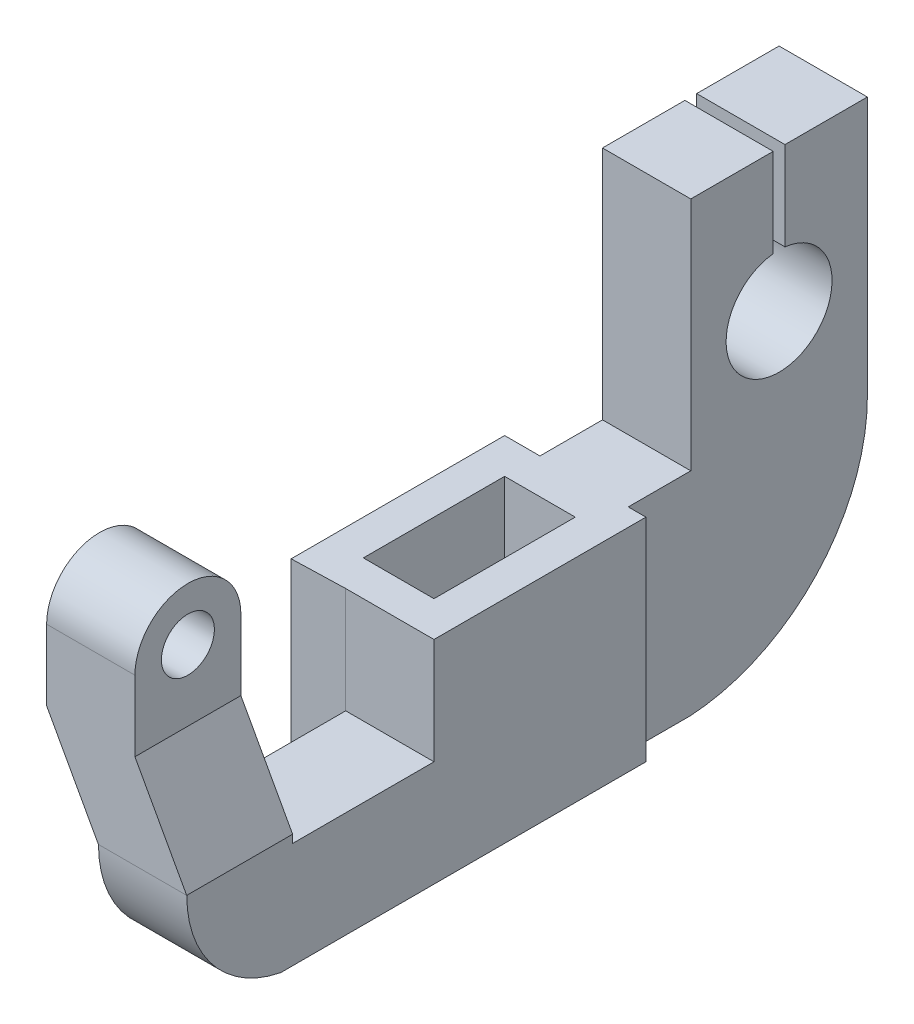
from build123d import *

# Parameters (mm, degrees)
BOSS_EXTRUDE1_DEPTH = 15
BOSS_EXTRUDE2_DEPTH = 18
BOSS_EXTRUDE3_DEPTH = 15
SKETCH4_R           = 4.5
CUT_EXTRUDE1_DEPTH  = 15
BOSS_EXTRUDE4_DEPTH = 36
SKETCH6_W           = 12
SKETCH6_H           = 24
CUT_EXTRUDE2_DEPTH  = 61.125389812
SKETCH7_W           = 15
SKETCH7_H           = 10.623328836
BOSS_EXTRUDE5_DEPTH = 36
BOSS_EXTRUDE6_DEPTH = 15


with BuildPart() as part:
    # Sketch1 → Boss-Extrude1 (new body)
    with BuildSketch(Plane(origin=(0, 0, 0), x_dir=(0, 0, -1), z_dir=(1, 0, 0))):
        with BuildLine():
            Line((-25.766620498, 0), (36.265250882, 0))
            Line((36.265250882, 0), (36.265250882, 36))
            Line((36.265250882, 36), (0.265250882, 36))
            Line((0.265250882, 36), (0.265250882, 18))
            Line((0.265250882, 18), (-23.734749118, 18))
            Line((-23.734749118, 18), (-23.734749118, 19.356781067))
            Line((-23.734749118, 19.356781067), (-41.734749118, 19.356781067))
            ThreePointArc((-41.734749118, 19.356781067), (-37.227535866, 6.810206785), (-25.766620498, 0))
        make_face()
    extrude(amount=-BOSS_EXTRUDE1_DEPTH)

    # Sketch2 → Boss-Extrude2 (add)
    with BuildSketch(Plane.XY.offset(23.75)):
        Polygon((-15, 19.356781067), (-23.791342675, 35.356781067), (-23.791342675, 47.356781067), (-8.791342675, 47.356781067), (-8.791342675, 35.356781067), (0, 19.356781067), align=None)
    extrude(amount=BOSS_EXTRUDE2_DEPTH)

    # Sketch3 → Boss-Extrude3 (add)
    with BuildSketch(Plane(origin=(-8.791342675, 0, 0), x_dir=(0, 0, -1), z_dir=(1, 0, 0))):
        with BuildLine():
            Line((-41.75, 47.356781067), (-23.75, 47.356781067))
            ThreePointArc((-23.75, 47.356781067), (-32.75, 56.356781067), (-41.75, 47.356781067))
        make_face()
    extrude(amount=-BOSS_EXTRUDE3_DEPTH)

    # Sketch4 → Cut-Extrude1 (cut)
    with BuildSketch(Plane(origin=(-8.791342675, 0, 0), x_dir=(0, 0, -1), z_dir=(1, 0, 0))):
        with Locations((-32.75, 47.356781067)):
            Circle(SKETCH4_R)
    extrude(amount=-CUT_EXTRUDE1_DEPTH, mode=Mode.SUBTRACT)


with BuildPart() as body_2:
    # Sketch5 → Boss-Extrude4 (new body)
    with BuildSketch(Plane(origin=(0, 36, 0), x_dir=(1, 0, 0), z_dir=(0, 1, 0))):
        Polygon((-15, 36.265250882), (-24, 36.265250882), (-24, 0), (-15, 0.265250882), align=None)
    extrude(amount=-BOSS_EXTRUDE4_DEPTH)


with BuildPart() as cut_extrude2_tool:
    # Sketch6 → Cut-Extrude2 (new, through all)
    with BuildSketch(Plane(origin=(0, 36, 0), x_dir=(1, 0, 0), z_dir=(0, 1, 0))):
        with Locations((-12, 18.265250882)):
            Rectangle(SKETCH6_W, SKETCH6_H)
    extrude(amount=-CUT_EXTRUDE2_DEPTH)


with BuildPart() as part_1:
    add(part.part)

    # Cut-Extrude2: cut by cut_extrude2_tool
    add(cut_extrude2_tool.part, mode=Mode.SUBTRACT)



with BuildPart() as body_2_1:
    add(body_2.part)

    # Cut-Extrude2: cut by cut_extrude2_tool
    add(cut_extrude2_tool.part, mode=Mode.SUBTRACT)


with BuildPart() as part_2:
    add(part_1.part)

    add(body_2_1.part)  # Boss-Extrude5 merges body 2
    # Sketch7 → Boss-Extrude5 (add)
    with BuildSketch(Plane(origin=(0, 36, 0), x_dir=(1, 0, 0), z_dir=(0, 1, 0))):
        with Locations((-10.5, 41.5769153)):
            Rectangle(SKETCH7_W, SKETCH7_H)
    extrude(amount=-BOSS_EXTRUDE5_DEPTH)

    # Sketch9 → Boss-Extrude6 (add)
    with BuildSketch(Plane(origin=(-3, 0, 0), x_dir=(0, 0, -1), z_dir=(1, 0, 0))):
        with BuildLine():
            Line((46.888579718, 76), (46.888579718, 36))
            Line((46.888579718, 36), (46.888579718, 0))
            ThreePointArc((46.888579718, 0), (68.212387297, 10.028536545), (76.888579718, 31.937438845))
            Line((76.888579718, 31.937438845), (76.888579718, 76))
            Line((76.888579718, 76), (62.888579718, 76))
            Line((62.888579718, 76), (62.888579718, 60.94427191))
            ThreePointArc((62.888579718, 60.94427191), (68.59678365, 58), (70.888579718, 52))
            ThreePointArc((70.888579718, 52), (55.888579718, 45.291796068), (60.888579718, 60.94427191))
            Line((60.888579718, 60.94427191), (60.888579718, 76))
            Line((60.888579718, 76), (46.888579718, 76))
        make_face()
    extrude(amount=-BOSS_EXTRUDE6_DEPTH)


solid = part_2.part
